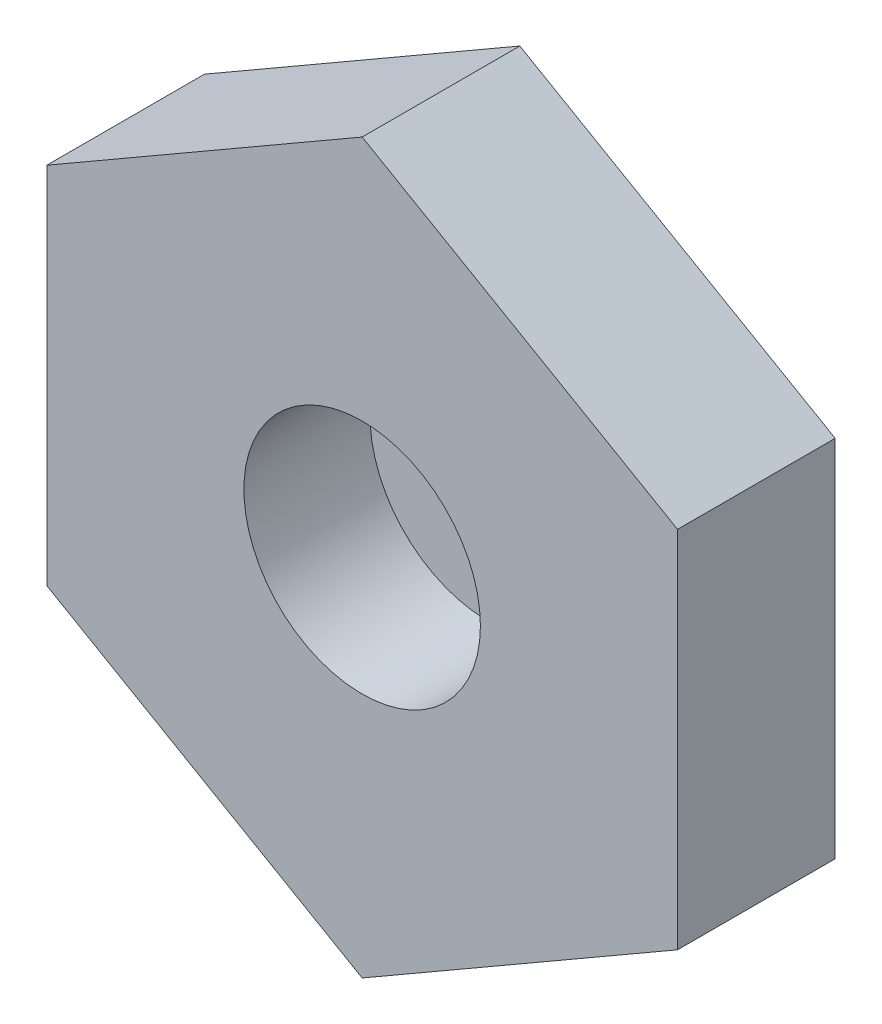
from build123d import *

# Parameters (mm, degrees)
BOSS_EXTRUDE1_DEPTH = 4
SKETCH2_R           = 3
CUT_EXTRUDE1_DEPTH  = 3.2


with BuildPart() as part:
    # Sketch1 → Boss-Extrude1 (new body)
    with BuildSketch(Plane.XY):
        Polygon((0, 9.237604307), (-8, 4.618802154), (-8, -4.618802154), (0, -9.237604307), (8, -4.618802154), (8, 4.618802154), align=None)
    extrude(amount=BOSS_EXTRUDE1_DEPTH)

    # Sketch2 → Cut-Extrude1 (cut)
    with BuildSketch(Plane.XY.offset(4)):
        Circle(SKETCH2_R)
    extrude(amount=-CUT_EXTRUDE1_DEPTH, mode=Mode.SUBTRACT)


solid = part.part
